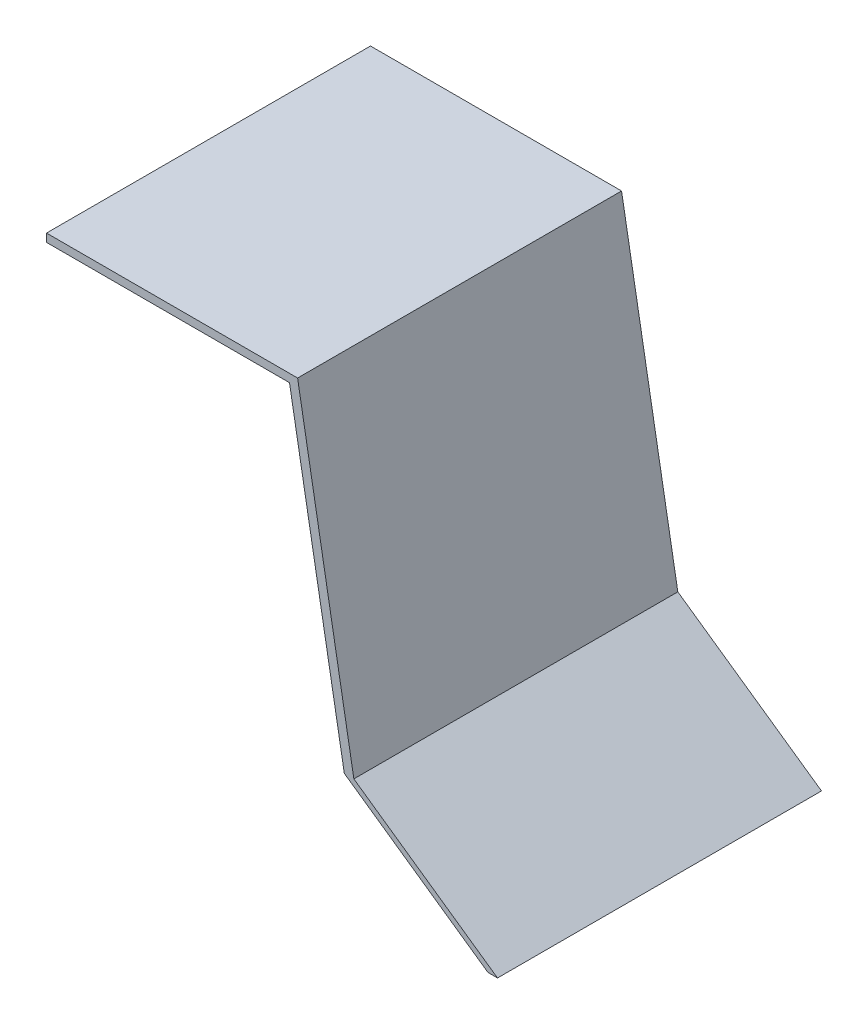
from build123d import *

# Parameters (mm, degrees)
SKETCH1_W           = 381
SKETCH1_H           = 508
BOSS_EXTRUDE1_DEPTH = 12.7
SKETCH3_R           = 6.35
BOSS_EXTRUDE2_DEPTH = 12.7
BOSS_EXTRUDE4_DEPTH = 508


with BuildPart() as part:
    # Sketch1 → Boss-Extrude1 (new body)
    with BuildSketch(Plane(origin=(0, 0, 0), x_dir=(1, 0, 0), z_dir=(0, 1, 0))):
        with Locations((317.5, 254)):
            Rectangle(SKETCH1_W, SKETCH1_H)
    extrude(amount=BOSS_EXTRUDE1_DEPTH)

    # Sketch3 → Boss-Extrude2 (add, symmetric)
    with BuildSketch(Plane(origin=(317.5, 0, 0), x_dir=(0, 0, -1), z_dir=(1, 0, 0))):
        with BuildLine():
            Line((228.6, 0), (228.6, -63.5))
            ThreePointArc((228.6, -63.5), (254, -88.9), (279.4, -63.5))
            Line((279.4, -63.5), (279.4, 0))
            Line((279.4, 0), (228.6, 0))
        make_face()
        with Locations((254, -63.5)):
            Circle(SKETCH3_R, mode=Mode.SUBTRACT)
    extrude(amount=BOSS_EXTRUDE2_DEPTH, both=True)

    # Sketch6 → Boss-Extrude4 (add)
    with BuildSketch(Plane.XY):
        Polygon((520.7, 12.7), (608.913274255, -487.58233853), (834.18077195, -645.31633853), (819.241419295, -645.31633853), (593.9739216, -487.58233853), (508, 0), (508, 12.7), align=None)
    extrude(amount=-BOSS_EXTRUDE4_DEPTH)


solid = part.part
